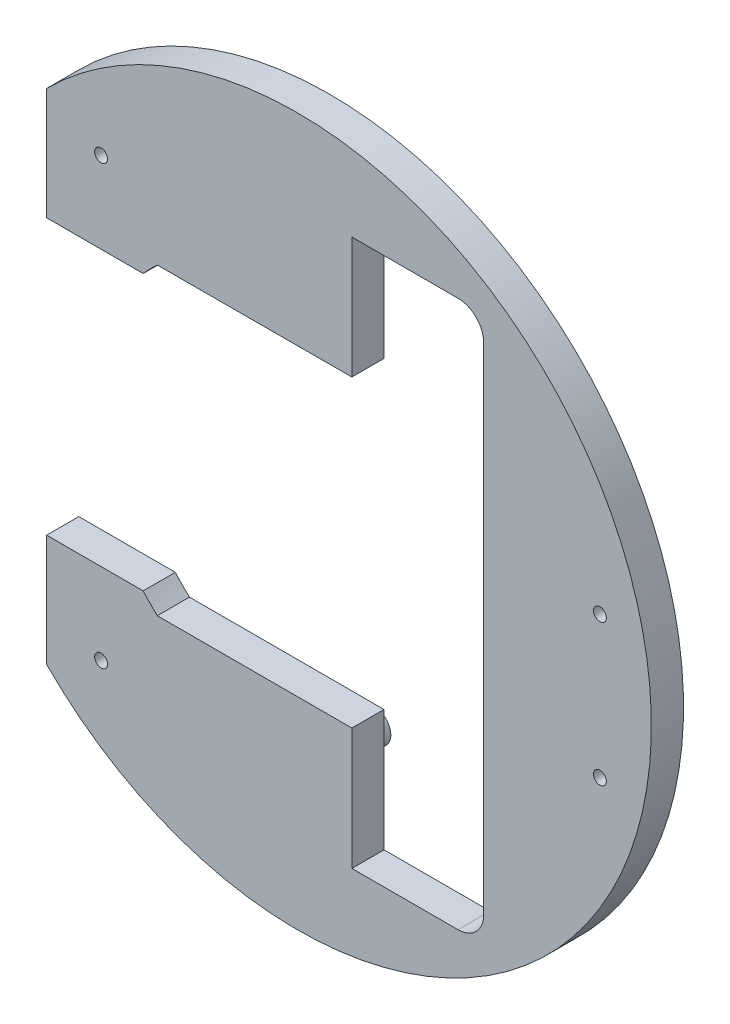
from build123d import *

# Parameters (mm, degrees)
BOSS_EXTRUDE1_DEPTH = 5
SKETCH2_R           = 2.5
BOSS_EXTRUDE2_DEPTH = 7
SKETCH3_R           = 1
CUT_EXTRUDE1_DEPTH  = 5


with BuildPart() as part:
    # Sketch1 → Boss-Extrude1 (new body)
    with BuildSketch(Plane.XY):
        with BuildLine():
            Line((8.444274161, -42.5), (8.444274161, -23.602240521))
            Line((8.444274161, -23.602240521), (-13.047599403, -23.602240521))
            Line((-13.047599403, -23.602240521), (-21.798721118, -23.602240521))
            ThreePointArc((-21.798721118, -23.602240521), (-22.926788134, -22.508051578), (-24, -21.360009363))
            Line((-24, -21.360009363), (-39, -21.360009363))
            Line((-39, -21.360009363), (-39, -38.781438859))
            ThreePointArc((-39, -38.781438859), (55, 0), (-39, 38.781438859))
            Line((-39, 38.781438859), (-39, 21.360009363))
            Line((-39, 21.360009363), (-24, 21.360009363))
            ThreePointArc((-24, 21.360009363), (-22.926788134, 22.508051578), (-21.798721118, 23.602240521))
            Line((-21.798721118, 23.602240521), (8.444274161, 23.653441006))
            Line((8.444274161, 23.653441006), (8.444274161, 42.5))
            Line((8.444274161, 42.5), (24.94401824, 42.5))
            ThreePointArc((24.94401824, 42.5), (27.772445365, 41.328427125), (28.94401824, 38.5))
            Line((28.94401824, 38.5), (28.94401824, -38.5))
            ThreePointArc((28.94401824, -38.5), (27.772445365, -41.328427125), (24.94401824, -42.5))
            Line((24.94401824, -42.5), (8.444274161, -42.5))
        make_face()
    extrude(amount=BOSS_EXTRUDE1_DEPTH)

    # Sketch2 → Boss-Extrude2 (add)
    with BuildSketch(Plane(origin=(0, 0, 0), x_dir=(-1, 0, 0), z_dir=(0, 0, -1))):
        with Locations(Location((0, -33.5, 0), (0, 0, 180))):
            Circle(SKETCH2_R)
        with Locations(Location((0, 33.5, 0), (0, 0, 180))):
            Circle(SKETCH2_R)
    extrude(amount=BOSS_EXTRUDE2_DEPTH)

    # Sketch3 → Cut-Extrude1 (cut)
    with BuildSketch(Plane.XY.offset(5)):
        with Locations((-30.537878891, -34)):
            Circle(SKETCH3_R)
        with Locations((-30.537878891, 34)):
            Circle(SKETCH3_R)
        with Locations((47, 11)):
            Circle(SKETCH3_R)
        with Locations((47, -11)):
            Circle(SKETCH3_R)
    extrude(amount=-CUT_EXTRUDE1_DEPTH, mode=Mode.SUBTRACT)


solid = part.part
